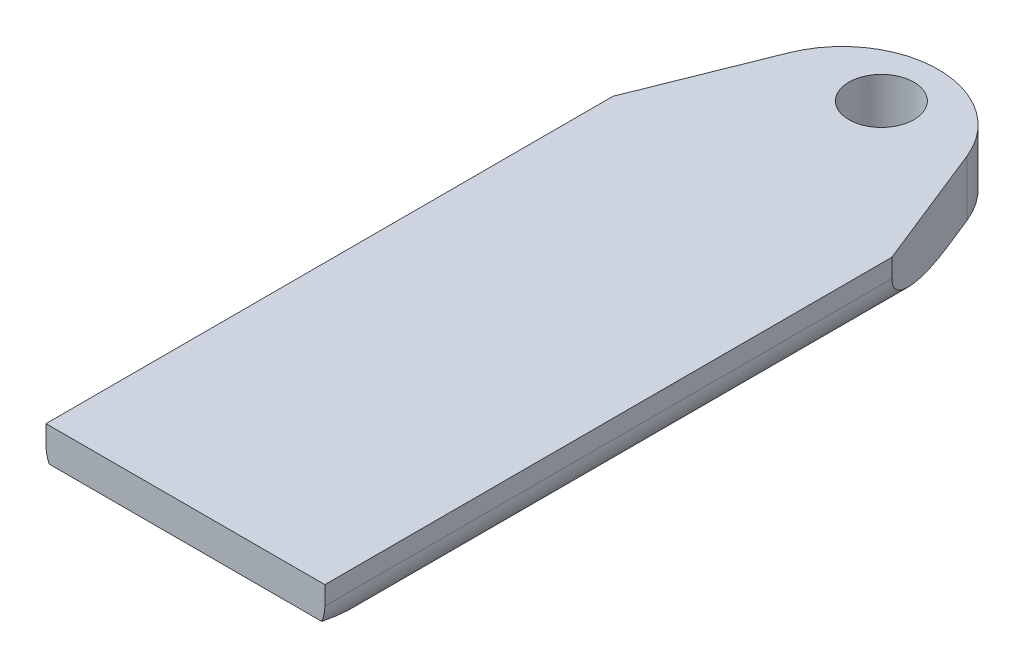
from build123d import *

# Parameters (mm, degrees)
CROQUIS1_W              = 15
CROQUIS1_H              = 3
SALIENTE_EXTRUIR1_DEPTH = 40.5
CROQUIS2_OUTSIDE_W      = 25.658
CROQUIS2_OUTSIDE_H      = 51.158
CROQUIS2_OUTSIDE_W_2    = 15
CROQUIS2_OUTSIDE_H_2    = 40.5
CROQUIS2_OUTSIDE_R      = 1.75
CORTAR_EXTRUIR1_DEPTH   = 40.5
CHAFL_N1_SIZE           = 4
CHAFL_N1_SIZE2          = 1.2
CHAFL_N2_SIZE           = 4
CHAFL_N2_SIZE2          = 10
REDONDEO1_R             = 2
REDONDEO2_R             = 5.169615


with BuildPart() as part:
    # Croquis1 → Saliente-Extruir1 (new body)
    with BuildSketch(Plane.XY):
        with Locations((0, 108.5)):
            Rectangle(CROQUIS1_W, CROQUIS1_H)
    extrude(amount=-SALIENTE_EXTRUIR1_DEPTH)

    # Croquis2 outside → Cortar-Extruir1 (cut)
    # profile 1 of 2: a face of its own
    with BuildSketch(Plane.XZ.offset(-107)):
        with Locations((0, -20.25)):
            Rectangle(CROQUIS2_OUTSIDE_W, CROQUIS2_OUTSIDE_H)
        with Locations((0, -20.25)):
            Rectangle(CROQUIS2_OUTSIDE_W_2, CROQUIS2_OUTSIDE_H_2, mode=Mode.SUBTRACT)
    # profile 2 of 2: a face of its own
    with BuildSketch(Plane.XZ.offset(-107)):
        with Locations(Location((-0.065549886, -37.5, 0), (0, 0, 270))):
            Circle(CROQUIS2_OUTSIDE_R)
    extrude(amount=-CORTAR_EXTRUIR1_DEPTH, mode=Mode.SUBTRACT)

    # Chaflán1
    chafl_n1_edges = [part.edges().sort_by_distance(p)[0] for p in [
        (0, 107, 0),
    ]]
    chafl_n1_side = [part.faces().sort_by_distance(p)[0] for p in [
        (0.001054835, 107, -19.972411249),
    ]]
    chamfer(chafl_n1_edges, length=CHAFL_N1_SIZE, length2=CHAFL_N1_SIZE2, reference=chafl_n1_side[0])

    # Chaflán2
    chafl_n2_edges = [part.edges().sort_by_distance(p)[0] for p in [
        (7.5, 108.5, -40.5),
        (-7.5, 108.5, -40.5),
    ]]
    chafl_n2_side = [part.faces().sort_by_distance(p)[0] for p in [
        (0, 108.5, -40.5),
    ]]
    chamfer(chafl_n2_edges, length=CHAFL_N2_SIZE, length2=CHAFL_N2_SIZE2, reference=chafl_n2_side[0])

    # Redondeo1
    redondeo1_edges = [part.edges().sort_by_distance(p)[0] for p in [
        (-7.5, 107, -17.25),
        (7.5, 107, -17.25),
    ]]
    fillet(redondeo1_edges, radius=REDONDEO1_R)

    # Redondeo2
    redondeo2_edges = [part.edges().sort_by_distance(p)[0] for p in [
        (3.5, 108.5, -40.5),
        (-3.5, 108.5, -40.5),
    ]]
    fillet(redondeo2_edges, radius=REDONDEO2_R)


solid = part.part
